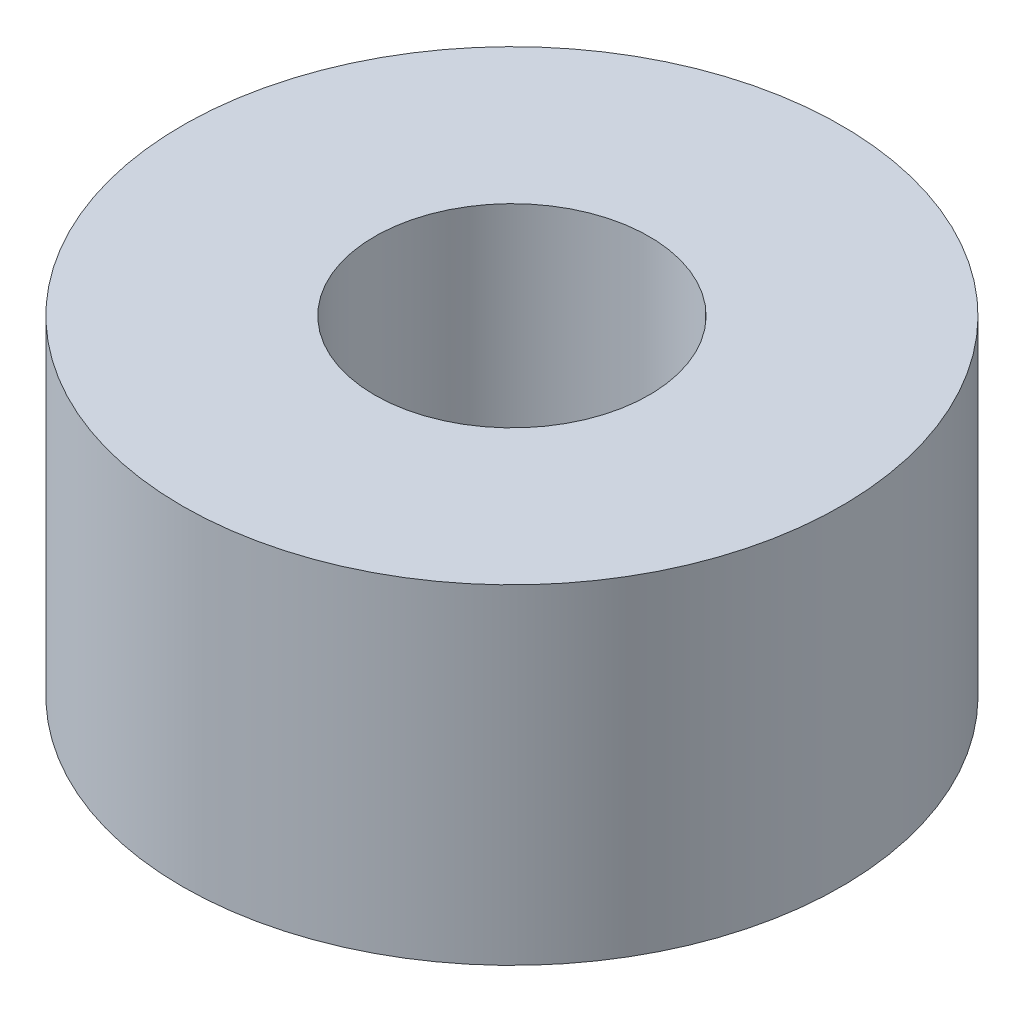
from build123d import *

# Parameters (mm, degrees)
SKETCH_1_R      = 3
SKETCH_1_R_2    = 1.25
EXTRUDE_1_DEPTH = 3


with BuildPart() as part:
    # 草图1 → 凸台-拉伸1 (new body)
    with BuildSketch(Plane(origin=(0, 0, 0), x_dir=(1, 0, 0), z_dir=(0, 1, 0))):
        with Locations(Location((0, 0, 0), (0, 0, 270))):
            Circle(SKETCH_1_R)
        with Locations(Location((0, 0, 0), (0, 0, 270))):
            Circle(SKETCH_1_R_2, mode=Mode.SUBTRACT)
    extrude(amount=EXTRUDE_1_DEPTH)


solid = part.part
